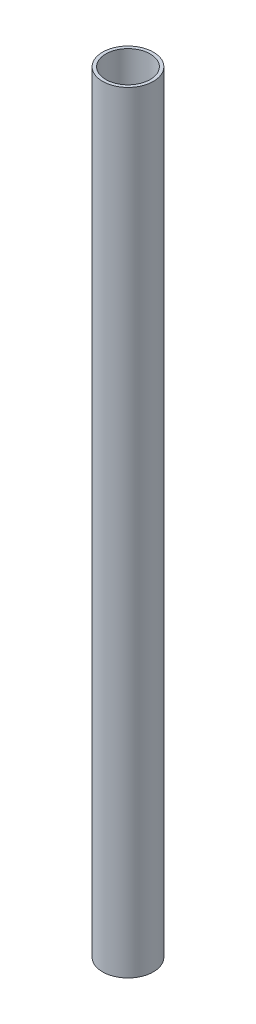
from build123d import *

# Parameters (mm, degrees)
SKETCH1_R           = 8
SKETCH1_R_2         = 7
BOSS_EXTRUDE1_DEPTH = 243.065


with BuildPart() as part:
    # Sketch1 → Boss-Extrude1 (new body)
    with BuildSketch(Plane(origin=(0, 0, 0), x_dir=(1, 0, 0), z_dir=(0, 1, 0))):
        with Locations(Location((0, 0, 0), (0, 0, 270))):
            Circle(SKETCH1_R)
        with Locations(Location((0, 0, 0), (0, 0, 270))):
            Circle(SKETCH1_R_2, mode=Mode.SUBTRACT)
    extrude(amount=BOSS_EXTRUDE1_DEPTH)


solid = part.part
